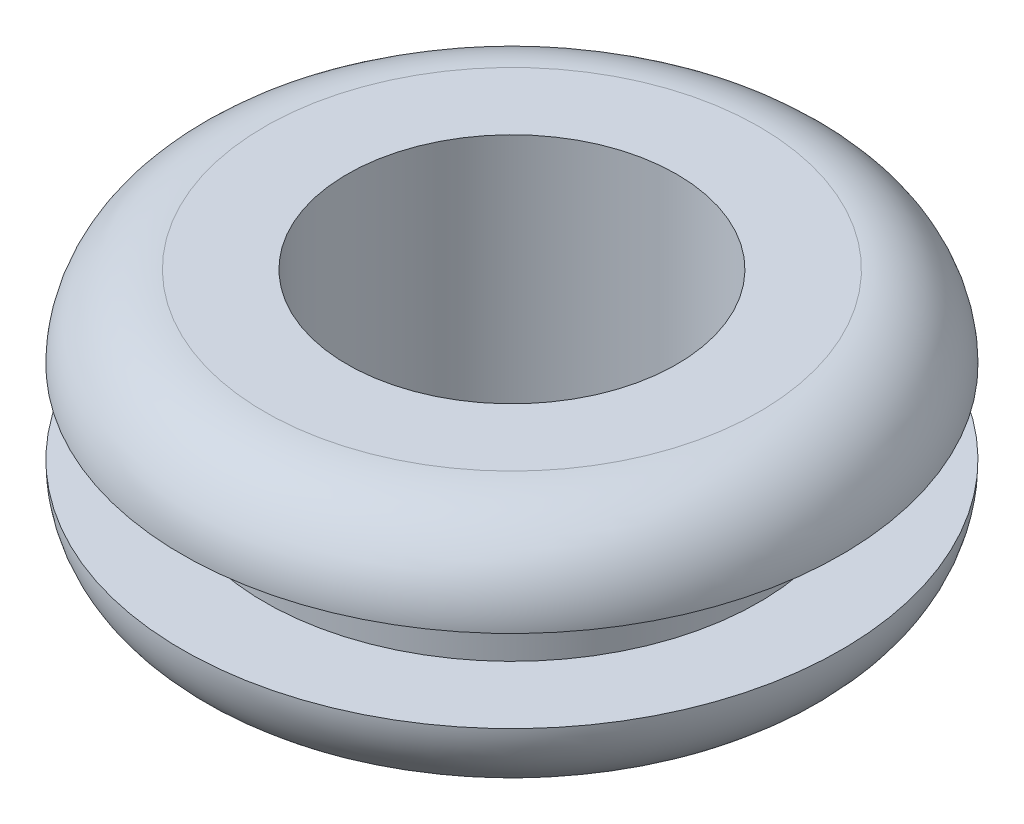
from build123d import *


with BuildPart() as part:
    # Sketch2 → Revolve1 (revolve)
    with BuildSketch(Plane(origin=(0, 0, 0), x_dir=(0, 0, -1), z_dir=(1, 0, 0)), mode=Mode.PRIVATE) as revolve1_sk:
        with BuildLine():
            Line((-3.175, -2.38125), (-3.175, 2.38125))
            Line((-3.175, 2.38125), (-4.7625, 2.38125))
            ThreePointArc((-4.7625, 2.38125), (-5.885032015, 1.916282015), (-6.35, 0.79375))
            Line((-6.35, 0.79375), (-4.7625, 0.79375))
            Line((-4.7625, 0.79375), (-4.7625, -0.79375))
            Line((-4.7625, -0.79375), (-6.35, -0.79375))
            ThreePointArc((-6.35, -0.79375), (-5.885032015, -1.916282015), (-4.7625, -2.38125))
            Line((-4.7625, -2.38125), (-3.175, -2.38125))
        make_face()
    revolve(revolve1_sk.sketch.rotate(Axis((0, -2.38125, 0), (0, 1, 0)), 180), axis=Axis((0, -2.38125, 0), (0, 1, 0)))


solid = part.part
